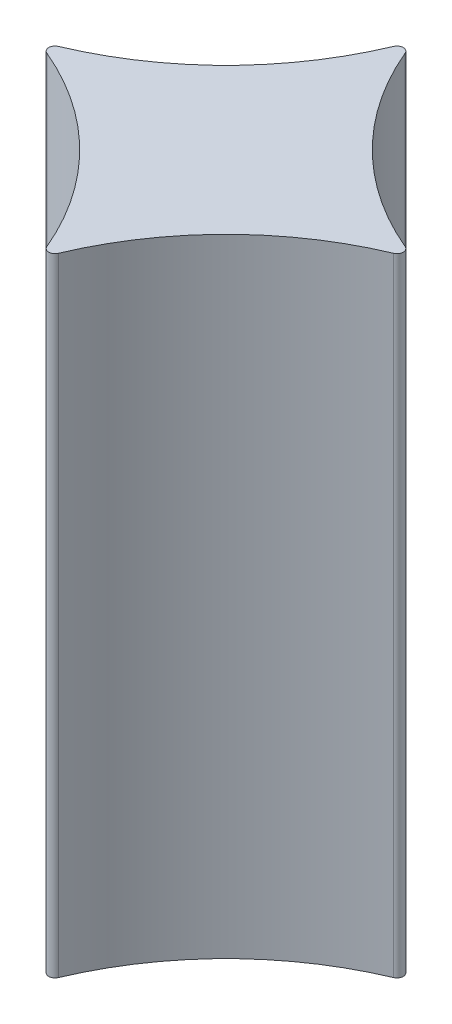
from build123d import *

# Parameters (mm, degrees)
BOSS_EXTRUDE1_DEPTH = 10


with BuildPart() as part:
    # Sketch1 → Boss-Extrude1 (new body)
    with BuildSketch(Plane(origin=(0, 0, 0), x_dir=(1, 0, 0), z_dir=(0, 1, 0))):
        with BuildLine():
            ThreePointArc((-0.092187493, 2.764124234), (-1.166028213, 1.166028213), (-2.764124234, 0.092187493))
            ThreePointArc((-2.764124234, 0.092187493), (-2.825375477, 0), (-2.764124234, -0.092187493))
            ThreePointArc((-2.764124234, -0.092187493), (-1.166028213, -1.166028213), (-0.092187493, -2.764124234))
            ThreePointArc((-0.092187493, -2.764124234), (0, -2.825375477), (0.092187493, -2.764124234))
            ThreePointArc((0.092187493, -2.764124234), (1.166028213, -1.166028213), (2.764124234, -0.092187493))
            ThreePointArc((2.764124234, -0.092187493), (2.825375477, 0), (2.764124234, 0.092187493))
            ThreePointArc((2.764124234, 0.092187493), (1.166028213, 1.166028213), (0.092187493, 2.764124234))
            ThreePointArc((0.092187493, 2.764124234), (0, 2.825375477), (-0.092187493, 2.764124234))
        make_face()
    extrude(amount=BOSS_EXTRUDE1_DEPTH)


solid = part.part
